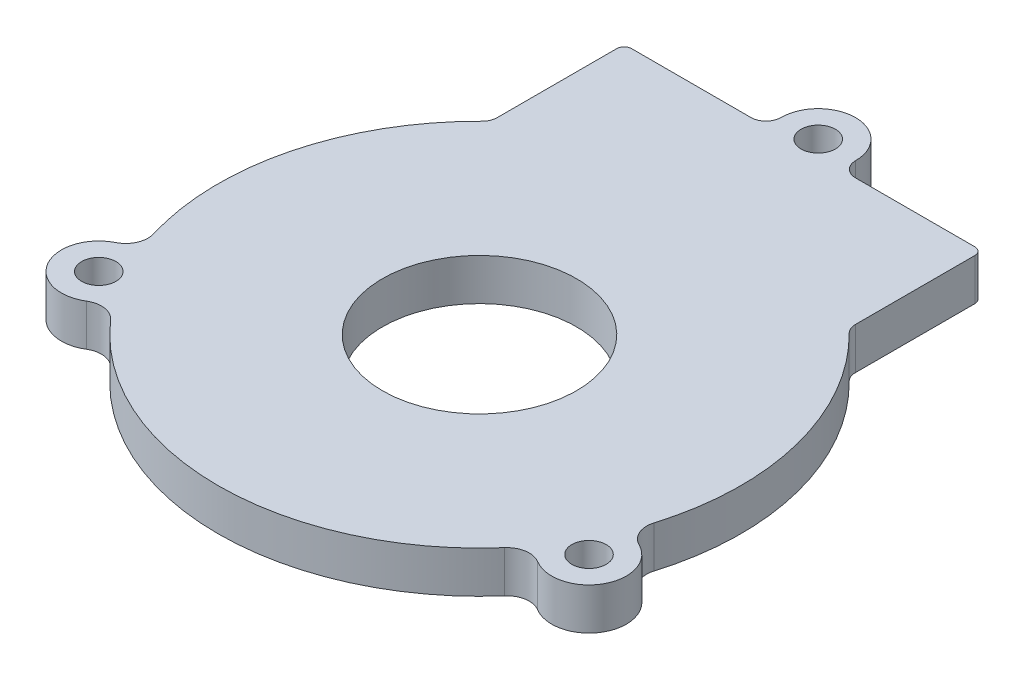
from build123d import *

# Parameters (mm, degrees)
SKETCH1_R                  = 35
SKETCH1_R_2                = 13
SKETCH1_R_3                = 5
SKETCH1_R_4                = 2.3
SKETCH1_W                  = 47.96
SKETCH1_H                  = 25
BOSS_EXTRUDE3_DEPTH        = 5.588
F_4_6_4_6_DIAMETER_HOLE1_D = 4.6
FILLET1_R                  = 3
FILLET2_R                  = 2
FILLET3_R                  = 2
FILLET4_R                  = 1


with BuildPart() as part:
    # Sketch1 → Boss-Extrude3 (new body)
    # profile 1 of 5: a face of its own
    with BuildSketch(Plane(origin=(0, 0, 0), x_dir=(1, 0, 0), z_dir=(0, 1, 0))):
        with Locations((32.785, 23.351471482)):
            Circle(SKETCH1_R)
        with Locations(Location((32.785, 23.351471482, 0), (0, 0, 270))):
            Circle(SKETCH1_R_2, mode=Mode.SUBTRACT)
    # profile 2 of 5: a face of its own
    with BuildSketch(Plane(origin=(0, 0, 0), x_dir=(1, 0, 0), z_dir=(0, 1, 0))):
        with Locations((65.600049901, 5.201471482)):
            Circle(SKETCH1_R_3)
        with Locations(Location((65.600049901, 5.201471482, 0), (0, 0, 270))):
            Circle(SKETCH1_R_4, mode=Mode.SUBTRACT)
    # profile 3 of 5: a face of its own
    with BuildSketch(Plane(origin=(0, 0, 0), x_dir=(1, 0, 0), z_dir=(0, 1, 0))):
        with Locations((-0.030049901, 5.201471482)):
            Circle(SKETCH1_R_3)
        with Locations(Location((-0.030049901, 5.201471482, 0), (0, 0, 270))):
            Circle(SKETCH1_R_4, mode=Mode.SUBTRACT)
    # profile 4 of 5: a face of its own
    with BuildSketch(Plane(origin=(0, 0, 0), x_dir=(1, 0, 0), z_dir=(0, 1, 0))):
        with Locations((32.785, 68.701471482)):
            Circle(SKETCH1_R_3)
    # profile 5 of 5: a face of its own
    with BuildSketch(Plane(origin=(0, 0, 0), x_dir=(1, 0, 0), z_dir=(0, 1, 0))):
        with Locations((32.785, 54.201471482)):
            Rectangle(SKETCH1_W, SKETCH1_H)
    extrude(amount=BOSS_EXTRUDE3_DEPTH)

    # Ø4.6 (4.6) Diameter Hole1 (through all)
    with Locations(Plane(origin=(0, 5.588, 0), x_dir=(1, 0, 0), z_dir=(0, 1, 0))):
        with Locations((32.785, 68.701471482)):
            Hole(F_4_6_4_6_DIAMETER_HOLE1_D / 2)

    # Fillet1
    fillet1_edges = [part.edges().sort_by_distance(p)[0] for p in [
        (65.214711372, 2.794, -10.18660079),
        (61.172514444, 2.794, -2.878342174),
        (0.355288628, 2.794, -10.18660079),
        (4.397485556, 2.794, -2.878342174),
    ]]
    fillet(fillet1_edges, radius=FILLET1_R)

    # Fillet2
    fillet2_edges = [part.edges().sort_by_distance(p)[0] for p in [
        (28.202424305, 2.794, -66.701471482),
        (37.367575695, 2.794, -66.701471482),
    ]]
    fillet(fillet2_edges, radius=FILLET2_R)

    # Fillet3
    fillet3_edges = [part.edges().sort_by_distance(p)[0] for p in [
        (8.805, 2.794, -48.845776728),
        (56.765, 2.794, -48.845776728),
    ]]
    fillet(fillet3_edges, radius=FILLET3_R)

    # Fillet4
    fillet4_edges = [part.edges().sort_by_distance(p)[0] for p in [
        (56.765, 2.794, -66.701471482),
        (8.805, 2.794, -66.701471482),
    ]]
    fillet(fillet4_edges, radius=FILLET4_R)


solid = part.part
